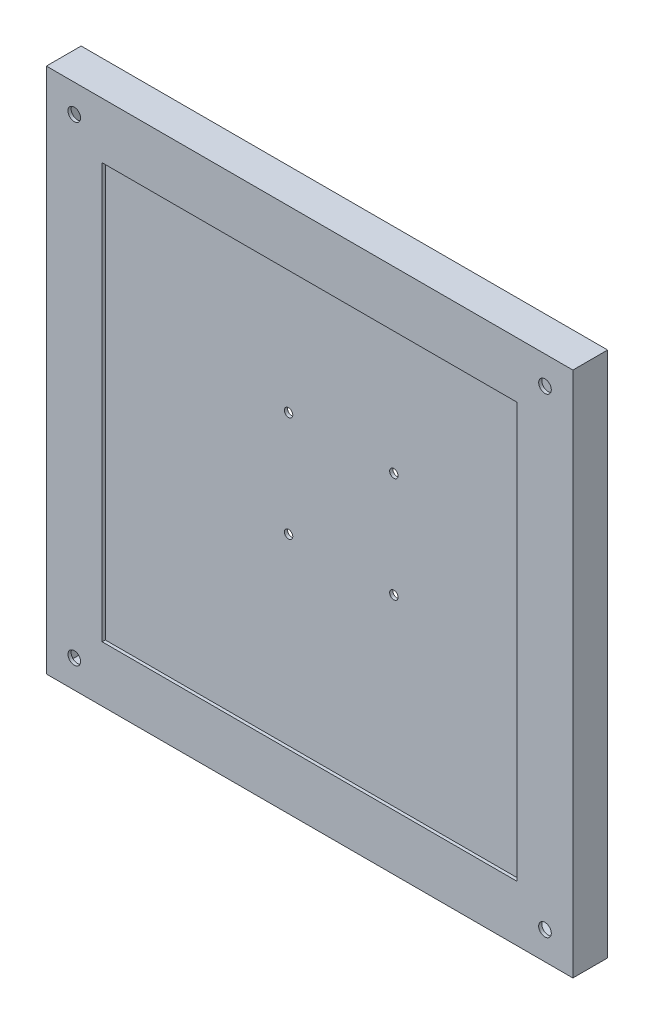
from build123d import *

# Parameters (mm, degrees)
SKETCH1_W           = 500
SKETCH1_H           = 500
BOSS_EXTRUDE1_DEPTH = 3
CUT_EXTRUDE1_REACH  = 355.566
SKETCH3_R           = 4
SKETCH4_W           = 500
SKETCH4_H           = 500
SKETCH4_W_2         = 494
SKETCH4_H_2         = 494
BOSS_EXTRUDE2_DEPTH = 30
SKETCH5_W           = 494
SKETCH5_H           = 494
SKETCH5_W_2         = 394
SKETCH5_H_2         = 394
BOSS_EXTRUDE3_DEPTH = 3
CUT_EXTRUDE2_REACH  = 357.09
SKETCH6_R           = 6


with BuildPart() as part:
    # Sketch1 → Boss-Extrude1 (new body)
    with BuildSketch(Plane.XY):
        Rectangle(SKETCH1_W, SKETCH1_H)
    extrude(amount=BOSS_EXTRUDE1_DEPTH)

    # Sketch3 → Cut-Extrude1 (cut, up to next)
    with BuildSketch(Plane(origin=(0, 0, 0), x_dir=(-1, 0, 0), z_dir=(0, 0, -1)), mode=Mode.PRIVATE) as cut_extrude1_sk1:
        with Locations((50, 50)):
            Circle(SKETCH3_R)
    cut_extrude1_tool1 = extrude(cut_extrude1_sk1.sketch, amount=-CUT_EXTRUDE1_REACH, mode=Mode.PRIVATE) & part.part
    # Sketch3 → Cut-Extrude1 (cut, up to next)
    with BuildSketch(Plane(origin=(0, 0, 0), x_dir=(-1, 0, 0), z_dir=(0, 0, -1)), mode=Mode.PRIVATE) as cut_extrude1_sk2:
        with Locations((-50, 50)):
            Circle(SKETCH3_R)
    cut_extrude1_tool2 = extrude(cut_extrude1_sk2.sketch, amount=-CUT_EXTRUDE1_REACH, mode=Mode.PRIVATE) & part.part
    # Sketch3 → Cut-Extrude1 (cut, up to next)
    with BuildSketch(Plane(origin=(0, 0, 0), x_dir=(-1, 0, 0), z_dir=(0, 0, -1)), mode=Mode.PRIVATE) as cut_extrude1_sk3:
        with Locations((50, -50)):
            Circle(SKETCH3_R)
    cut_extrude1_tool3 = extrude(cut_extrude1_sk3.sketch, amount=-CUT_EXTRUDE1_REACH, mode=Mode.PRIVATE) & part.part
    # Sketch3 → Cut-Extrude1 (cut, up to next)
    with BuildSketch(Plane(origin=(0, 0, 0), x_dir=(-1, 0, 0), z_dir=(0, 0, -1)), mode=Mode.PRIVATE) as cut_extrude1_sk4:
        with Locations((-50, -50)):
            Circle(SKETCH3_R)
    cut_extrude1_tool4 = extrude(cut_extrude1_sk4.sketch, amount=-CUT_EXTRUDE1_REACH, mode=Mode.PRIVATE) & part.part
    add(cut_extrude1_tool1.solids().sort_by_distance((-50, 50, 0))[0], mode=Mode.SUBTRACT)
    add(cut_extrude1_tool2.solids().sort_by_distance((50, 50, 0))[0], mode=Mode.SUBTRACT)
    add(cut_extrude1_tool3.solids().sort_by_distance((-50, -50, 0))[0], mode=Mode.SUBTRACT)
    add(cut_extrude1_tool4.solids().sort_by_distance((50, -50, 0))[0], mode=Mode.SUBTRACT)

    # Sketch4 → Boss-Extrude2 (add)
    with BuildSketch(Plane.XY.offset(3)):
        Rectangle(SKETCH4_W, SKETCH4_H)
        Rectangle(SKETCH4_W_2, SKETCH4_H_2, mode=Mode.SUBTRACT)
    extrude(amount=BOSS_EXTRUDE2_DEPTH)

    # Sketch5 → Boss-Extrude3 (add)
    with BuildSketch(Plane.XY.offset(33)):
        Rectangle(SKETCH5_W, SKETCH5_H)
        Rectangle(SKETCH5_W_2, SKETCH5_H_2, mode=Mode.SUBTRACT)
    extrude(amount=-BOSS_EXTRUDE3_DEPTH)

    # Sketch6 → Cut-Extrude2 (cut, up to next)
    with BuildSketch(Plane.XY.offset(33), mode=Mode.PRIVATE) as cut_extrude2_sk1:
        with Locations((-223.5, 223.5)):
            Circle(SKETCH6_R)
    cut_extrude2_tool1 = extrude(cut_extrude2_sk1.sketch, amount=-CUT_EXTRUDE2_REACH, mode=Mode.PRIVATE) & part.part
    # Sketch6 → Cut-Extrude2 (cut, up to next)
    with BuildSketch(Plane.XY.offset(33), mode=Mode.PRIVATE) as cut_extrude2_sk2:
        with Locations((223.5, 223.5)):
            Circle(SKETCH6_R)
    cut_extrude2_tool2 = extrude(cut_extrude2_sk2.sketch, amount=-CUT_EXTRUDE2_REACH, mode=Mode.PRIVATE) & part.part
    # Sketch6 → Cut-Extrude2 (cut, up to next)
    with BuildSketch(Plane.XY.offset(33), mode=Mode.PRIVATE) as cut_extrude2_sk3:
        with Locations((223.5, -223.5)):
            Circle(SKETCH6_R)
    cut_extrude2_tool3 = extrude(cut_extrude2_sk3.sketch, amount=-CUT_EXTRUDE2_REACH, mode=Mode.PRIVATE) & part.part
    # Sketch6 → Cut-Extrude2 (cut, up to next)
    with BuildSketch(Plane.XY.offset(33), mode=Mode.PRIVATE) as cut_extrude2_sk4:
        with Locations((-223.5, -223.5)):
            Circle(SKETCH6_R)
    cut_extrude2_tool4 = extrude(cut_extrude2_sk4.sketch, amount=-CUT_EXTRUDE2_REACH, mode=Mode.PRIVATE) & part.part
    add(cut_extrude2_tool1.solids().sort_by_distance((-223.5, 223.5, 33))[0], mode=Mode.SUBTRACT)
    add(cut_extrude2_tool2.solids().sort_by_distance((223.5, 223.5, 33))[0], mode=Mode.SUBTRACT)
    add(cut_extrude2_tool3.solids().sort_by_distance((223.5, -223.5, 33))[0], mode=Mode.SUBTRACT)
    add(cut_extrude2_tool4.solids().sort_by_distance((-223.5, -223.5, 33))[0], mode=Mode.SUBTRACT)


solid = part.part
